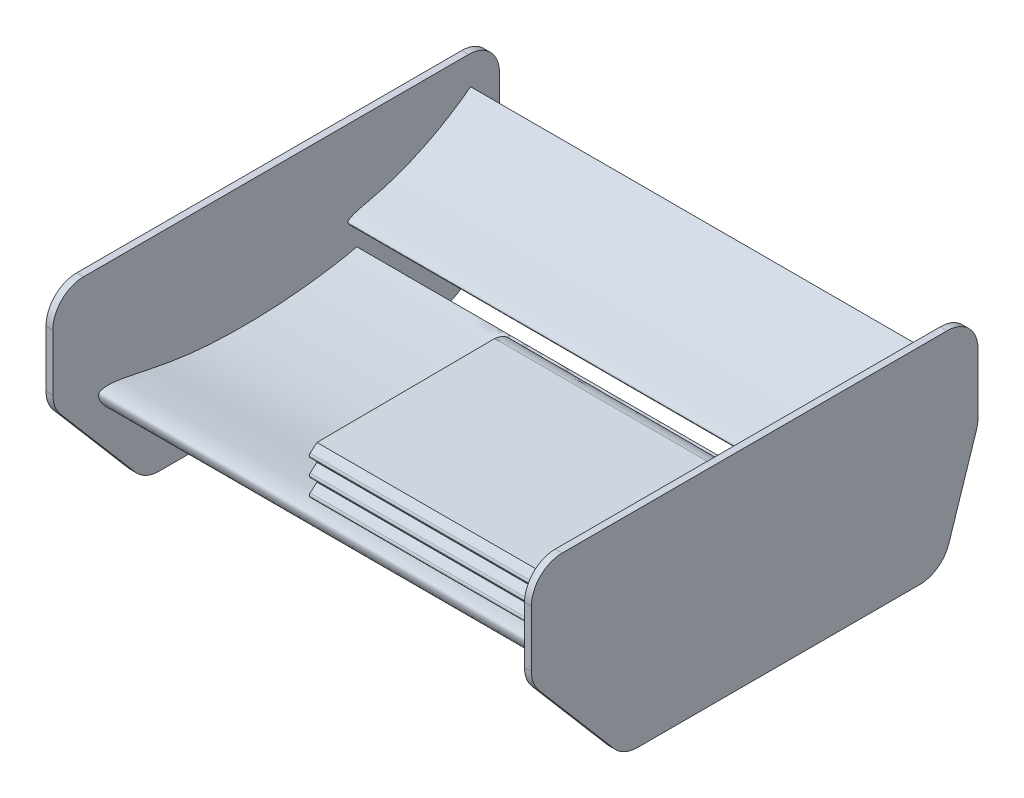
from build123d import *

# Parameters (mm, degrees)
EXTRUDED_AIRFOILS_DEPTH   = 487.449999952
EXTRUDED_AIRFOILS_2_DEPTH = 487.449999952
EXTRUDED_AIRFOILS_3_DEPTH = 487.449999952
EXTRUDED_AIRFOILS_4_DEPTH = 487.449999952
EXTRUDED_AIRFOILS_5_DEPTH = 487.449999952
EXTRUDED_ENDPLATE_DEPTH   = 14.200000048


with BuildPart() as part:
    # Airfoils Sketch → Extruded Airfoils (new body)
    with BuildSketch(Plane(origin=(0, 0, 0), x_dir=(0, 0, -1), z_dir=(1, 0, 0))):
        with BuildLine():
            add(Edge.make_bspline(
                [(897.989632302, 946.000000046), (898.000513914, 945.951839281), (894.184279323, 944.352851316), (890.699819702, 942.296180156), (882.791939538, 937.933635623), (873.645939793, 932.954112993), (861.849234489, 927.640797519), (847.825954561, 922.30857822), (831.530849272, 916.634932924), (813.2008765, 910.647350929), (793.094311676, 904.422943815), (771.513904823, 898.06413618), (748.758616882, 891.715468852), (725.138031005, 885.514054628), (700.954405569, 879.629236447), (676.498467134, 874.257660211), (652.057841056, 869.565934163), (627.831804234, 865.795405193), (603.922786486, 863.282964935), (580.420628735, 862.073173574), (557.409835441, 862.139402028), (535.014387038, 863.428748658), (513.364868859, 865.878949834), (492.614715532, 869.402461043), (472.917623861, 873.841507376), (454.449730598, 879.083530955), (437.385501316, 885.029883679), (421.874189905, 891.561628897), (408.048549489, 898.559233256), (396.013645082, 905.891109977), (385.858554918, 913.416953036), (377.637446771, 920.978739297), (371.3813299, 928.395891647), (367.105151877, 935.48676691), (364.93961271, 941.592944474), (364.478646936, 945.808092476), (364.72423345, 948.022458751), (364.958745374, 949.103505513), (365.207345688, 949.805698607), (365.433998761, 950.327271857), (365.635213878, 950.682005569), (365.862098213, 951.012091726), (366.146275406, 951.304038649), (366.468830129, 951.577773117), (366.958374644, 951.951982083), (367.677617136, 952.372493507), (368.829149529, 952.929808373), (370.247862327, 953.455636597), (373.990203501, 954.551133318), (380.956406634, 955.316418787), (391.975654885, 955.164476466), (405.835940211, 953.699088451), (422.612261866, 950.928158747), (442.470944413, 946.830199159), (465.539283336, 941.749563758), (491.828789906, 936.399518652), (521.027342465, 931.264471412), (552.59555029, 926.799070536), (585.816105194, 923.592309215), (619.824369214, 921.766444825), (653.851796059, 920.998850705), (687.331665883, 921.160230805), (719.756890506, 922.202805035), (750.588370802, 924.122270917), (779.304150897, 926.732212739), (805.469395405, 929.729342209), (828.782042195, 932.897265457), (848.904387076, 936.025543084), (865.887900109, 938.991006858), (878.885329483, 941.41974614), (889.414050412, 943.814205441), (893.791195704, 944.72287816), (897.978579692, 946.048917629), (897.989632302, 946.000000046)],
                knots=[0, 0, 0, 0, 0.001812691, 0.006911328, 0.014576348, 0.024172143, 0.035572242, 0.04901308, 0.064512615, 0.081849281, 0.100772139, 0.120997345, 0.142228397, 0.164173399, 0.186536734, 0.209022727, 0.231367049, 0.253319655, 0.274803883, 0.295858285, 0.316448578, 0.336530716, 0.35603337, 0.374893008, 0.392989986, 0.410197087, 0.426388181, 0.441458696, 0.455334222, 0.467938119, 0.479235883, 0.48920359, 0.497850586, 0.505193934, 0.511308341, 0.515097163, 0.516441428, 0.517272652, 0.518060388, 0.518436362, 0.518797413, 0.519153544, 0.519507976, 0.519886846, 0.520288641, 0.521160208, 0.522116283, 0.523720315, 0.52521352, 0.532574604, 0.542380648, 0.554776211, 0.56993128, 0.588004893, 0.609187965, 0.63332852, 0.660001247, 0.688743434, 0.718873444, 0.749542513, 0.780126844, 0.81020899, 0.839387288, 0.867183376, 0.893104481, 0.916760447, 0.937874173, 0.956198632, 0.971543675, 0.983762849, 0.992691516, 0.998158824, 1, 1, 1, 1], degree=3))
        make_face()
    extrude(amount=EXTRUDED_AIRFOILS_DEPTH)



with BuildPart() as body_2:
    # Airfoils Sketch → Extruded Airfoils 2 (new body)
    with BuildSketch(Plane(origin=(0, 0, 0), x_dir=(0, 0, -1), z_dir=(1, 0, 0))):
        with BuildLine():
            add(Edge.make_bspline(
                [(1133.247895197, 1114.879542376), (1133.263722473, 1114.859087767), (1131.806001628, 1113.25519051), (1130.607103196, 1111.507461609), (1127.818717185, 1107.685840221), (1124.579136733, 1103.297234833), (1120.155072018, 1098.163376496), (1114.678164398, 1092.527643798), (1108.198329078, 1086.226907711), (1100.821972353, 1079.326674016), (1092.654635701, 1071.920724909), (1083.817370556, 1064.12470491), (1074.420106224, 1056.073413691), (1064.579459073, 1047.900476053), (1054.401433329, 1039.753195997), (1043.980514589, 1031.789286322), (1033.416365688, 1024.151513447), (1022.750162563, 1016.998566842), (1011.955953794, 1010.513055004), (1001.066525449, 1004.736020325), (990.127889471, 999.673527988), (979.210614335, 995.327909586), (968.390476554, 991.698514411), (957.759696413, 988.777748272), (947.426165666, 986.524734356), (937.498419283, 984.925029416), (928.081119643, 983.970423676), (919.271451623, 983.63749458), (911.158898739, 983.898883494), (903.822468342, 984.715380277), (897.33550853, 986.040096456), (891.758716327, 987.81000449), (887.146787462, 989.946243092), (883.547028652, 992.365889283), (881.167242998, 994.785302552), (880.015293983, 996.684326263), (879.641684401, 997.789924081), (879.513701957, 998.355046525), (879.476275125, 998.743433531), (879.468413302, 999.041215906), (879.485408764, 999.254162868), (879.520046508, 999.461091263), (879.59032598, 999.662596722), (879.682856237, 999.863951825), (879.832419813, 1000.149972229), (880.080778475, 1000.5088225), (880.504074889, 1001.028314482), (881.061180809, 1001.592004847), (882.595280633, 1002.940520477), (885.732952339, 1004.845945107), (890.997784961, 1007.213160315), (897.902110048, 1009.585764522), (906.479782474, 1011.984112713), (916.814518812, 1014.434823253), (928.890520217, 1017.129551851), (942.5553547, 1020.409457485), (957.553613901, 1024.435409414), (973.528585227, 1029.303838406), (990.009352771, 1035.135567193), (1006.558380368, 1041.797229165), (1022.882234338, 1048.96552869), (1038.740496723, 1056.453629105), (1053.903013356, 1064.126592787), (1068.114808727, 1071.863036041), (1081.169360459, 1079.458915104), (1092.927377374, 1086.673988972), (1103.293364143, 1093.338660471), (1112.153586842, 1099.278269075), (1119.55974592, 1104.445736805), (1125.192396428, 1108.475998694), (1129.660659044, 1111.943485137), (1131.537478613, 1113.343836836), (1133.231819204, 1114.900318417), (1133.247895197, 1114.879542376)],
                knots=[0, 0, 0, 0, 0.001812691, 0.006911328, 0.014576348, 0.024172143, 0.035572242, 0.04901308, 0.064512615, 0.081849281, 0.100772139, 0.120997345, 0.142228397, 0.164173399, 0.186536734, 0.209022727, 0.231367049, 0.253319655, 0.274803883, 0.295858285, 0.316448578, 0.336530716, 0.35603337, 0.374893008, 0.392989986, 0.410197087, 0.426388181, 0.441458696, 0.455334222, 0.467938119, 0.479235883, 0.48920359, 0.497850586, 0.505193934, 0.511308341, 0.515097163, 0.516441428, 0.517272652, 0.518060388, 0.518436362, 0.518797413, 0.519153544, 0.519507976, 0.519886846, 0.520288641, 0.521160208, 0.522116283, 0.523720315, 0.52521352, 0.532574604, 0.542380648, 0.554776211, 0.56993128, 0.588004893, 0.609187965, 0.63332852, 0.660001247, 0.688743434, 0.718873444, 0.749542513, 0.780126844, 0.81020899, 0.839387288, 0.867183376, 0.893104481, 0.916760447, 0.937874173, 0.956198632, 0.971543675, 0.983762849, 0.992691516, 0.998158824, 1, 1, 1, 1], degree=3))
        make_face()
    extrude(amount=EXTRUDED_AIRFOILS_2_DEPTH)


with BuildPart() as body_3:
    # Airfoils Sketch → Extruded Airfoils 3 (new body)
    with BuildSketch(Plane(origin=(0, 0, 0), x_dir=(0, 0, -1), z_dir=(1, 0, 0))):
        with BuildLine():
            Line((328.346158804, 1124.317117132), (695.630158804, 1126.631504282))
            add(Edge.make_bspline(
                [(695.630158804, 1126.631504282), (710.297927514, 1124.745150831), (728.004440219, 1117.255214135), (730.385770247, 1100.582244901)],
                knots=[0, 0, 0, 0, 0.846941723, 0.846941723, 0.846941723, 0.846941723], degree=3))
            ThreePointArc((730.385770247, 1100.582244901), (728.301346358, 1095.724404705), (723.028542646, 1095.348937884))
            add(Edge.make_bspline(
                [(695.630161664, 1103.771050453), (707.550930057, 1101.184003768), (713.945578954, 1100.032731443), (723.028542646, 1095.348937884)],
                knots=[0, 0, 0, 0, 0.774369871, 0.774369871, 0.774369871, 0.774369871], degree=3))
            Line((695.630161664, 1103.771050453), (603.556478464, 1103.190861419))
            Line((603.556478464, 1103.190861419), (317.469923746, 1103.190861419))
            ThreePointArc((317.469923746, 1103.190861419), (312.706649911, 1106.505182406), (314.158737666, 1112.123451034))
            Line((314.158737666, 1112.123451034), (328.346158804, 1124.317117132))
        make_face()
    extrude(amount=EXTRUDED_AIRFOILS_3_DEPTH)


with BuildPart() as body_4:
    # Airfoils Sketch → Extruded Airfoils 4 (new body)
    with BuildSketch(Plane(origin=(0, 0, 0), x_dir=(0, 0, -1), z_dir=(1, 0, 0))):
        with BuildLine():
            Line((328.347171773, 1088.75641753), (670.231171773, 1090.910750244))
            add(Edge.make_bspline(
                [(670.231171773, 1090.910750244), (687.164543096, 1091.532191467), (698.558484663, 1081.121037501), (700.775556151, 1066.57304042)],
                knots=[0, 0, 0, 0, 0.809070721, 0.809070721, 0.809070721, 0.809070721], degree=3))
            ThreePointArc((700.775556151, 1066.57304042), (698.54675871, 1061.564549625), (693.065152699, 1061.497366128))
            add(Edge.make_bspline(
                [(670.231174632, 1068.050296415), (678.226278362, 1068.017239749), (686.317216082, 1065.706103204), (693.065152699, 1061.497366128)],
                knots=[0, 0, 0, 0, 0.706874062, 0.706874062, 0.706874062, 0.706874062], degree=3))
            Line((670.231174632, 1068.050296415), (603.525196368, 1067.629958314))
            Line((603.525196368, 1067.629958314), (317.470699937, 1067.629958314))
            ThreePointArc((317.470699937, 1067.629958314), (312.707426103, 1070.944279301), (314.159513858, 1076.562547929))
            Line((314.159513858, 1076.562547929), (328.347171773, 1088.75641753))
        make_face()
    extrude(amount=EXTRUDED_AIRFOILS_4_DEPTH)


with BuildPart() as body_5:
    # Airfoils Sketch → Extruded Airfoils 5 (new body)
    with BuildSketch(Plane(origin=(0, 0, 0), x_dir=(0, 0, -1), z_dir=(1, 0, 0))):
        with BuildLine():
            Line((328.348184741, 1053.195717928), (644.832184741, 1055.189996206))
            add(Edge.make_bspline(
                [(644.832184741, 1055.189996206), (661.463182213, 1055.451805684), (673.161701107, 1045.490105259), (675.655459453, 1030.877935781)],
                knots=[0, 0, 0, 0, 0.816938356, 0.816938356, 0.816938356, 0.816938356], degree=3))
            ThreePointArc((675.655459453, 1030.877935781), (673.569004101, 1025.867204461), (668.147756659, 1025.601120882))
            add(Edge.make_bspline(
                [(644.832187601, 1032.329542376), (653.010198277, 1031.961993745), (661.077346864, 1029.598397086), (668.147756659, 1025.601120882)],
                knots=[0, 0, 0, 0, 0.717847304, 0.717847304, 0.717847304, 0.717847304], degree=3))
            Line((644.832187601, 1032.329542376), (603.493914271, 1032.069055209))
            Line((603.493914271, 1032.069055209), (317.471476129, 1032.069055209))
            ThreePointArc((317.471476129, 1032.069055209), (312.708202294, 1035.383376196), (314.160290049, 1041.001644825))
            Line((314.160290049, 1041.001644825), (328.348184741, 1053.195717928))
        make_face()
    extrude(amount=EXTRUDED_AIRFOILS_5_DEPTH)


with BuildPart() as part_1:
    add(part.part)

    add(body_2.part)  # Extruded Endplate merges body 2
    # Endplate Sketch → Extruded Endplate (add)
    with BuildSketch(Plane(origin=(501.65, 0, 0), x_dir=(0, 0, -1), z_dir=(1, 0, 0))):
        with BuildLine():
            Line((333.44768579, 1174.600000046), (1129.475, 1174.600000046))
            ThreePointArc((1129.475, 1174.600000046), (1174.376280605, 1156.001280651), (1192.975, 1111.100000046))
            Line((1192.975, 1111.100000046), (1192.975, 986.671665425))
            ThreePointArc((1192.975, 986.671665425), (1192.187961727, 976.704999408), (1189.846356489, 966.985393159))
            Line((1189.846356489, 966.985393159), (1132.89690026, 792.340042461))
            ThreePointArc((1132.89690026, 792.340042461), (1109.822807151, 760.634057096), (1072.525543772, 748.526314727))
            Line((1072.525543772, 748.526314727), (489.177152122, 748.526314727))
            ThreePointArc((489.177152122, 748.526314727), (462.584654451, 754.362729445), (440.880498348, 770.799099999))
            Line((440.880498348, 770.799099999), (285.151032016, 953.232285636))
            ThreePointArc((285.151032016, 953.232285636), (273.869638177, 972.488923615), (269.94768579, 994.459500364))
            Line((269.94768579, 994.459500364), (269.94768579, 1111.100000046))
            ThreePointArc((269.94768579, 1111.100000046), (288.546405185, 1156.001280651), (333.44768579, 1174.600000046))
        make_face()
    extrude(amount=-EXTRUDED_ENDPLATE_DEPTH)

    # Mirror 2: part across plane


with BuildPart() as part_2:
    add(part_1.part)
    add(part_1.part.mirror(Plane(origin=(0, 0, 0), x_dir=(0, 0, 1), z_dir=(1, 0, 0))))


solid = Compound([body_3.part, body_4.part, body_5.part, part_2.part])
